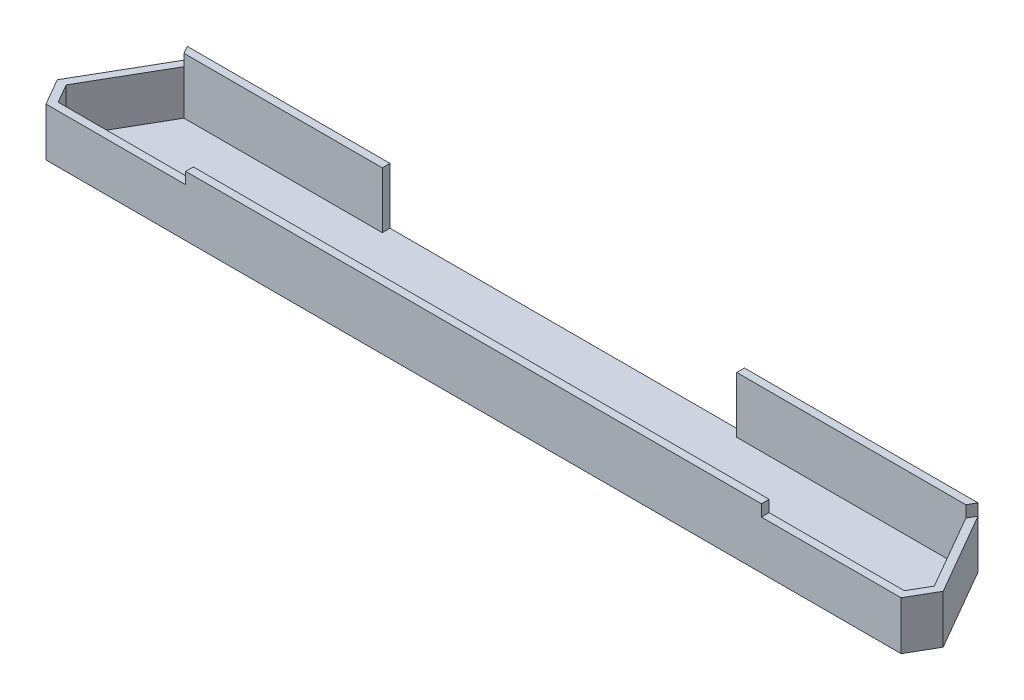
from build123d import *

# Parameters (mm, degrees)
BOSS_EXTRUDE1_DEPTH = 1
BOSS_EXTRUDE2_DEPTH = 12.58
SKETCH1_4_W         = 149.48
SKETCH1_4_H         = 2
BOSS_EXTRUDE3_DEPTH = 15.58
SKETCH1_5_W         = 92.02
SKETCH1_5_H         = 2
BOSS_EXTRUDE4_DEPTH = 1


with BuildPart() as part:
    # Sketch1 → Boss-Extrude1 (new body)
    with BuildSketch(Plane(origin=(0, 0, 0), x_dir=(1, 0, 0), z_dir=(0, 1, 0))):
        Polygon((-50.01, 19.39179677), (-101.494739838, 19.39179677), (-112.690598923, 0), (-109.845299462, -4.92820323), (-74.74, -4.92820323), (74.74, -4.92820323), (109.845299462, -4.92820323), (112.690598923, 0), (101.494739838, 19.39179677), (42.01, 19.39179677), align=None)
    extrude(amount=BOSS_EXTRUDE1_DEPTH)

    # Sketch1<3> → Boss-Extrude2 (add)
    with BuildSketch(Plane(origin=(0, 0, 0), x_dir=(1, 0, 0), z_dir=(0, 1, 0))):
        Polygon((-115, 0), (-111, -6.92820323), (-74.74, -6.92820323), (-74.74, -4.92820323), (-109.845299462, -4.92820323), (-112.690598923, 0), (-101.494739838, 19.39179677), (-102.649440377, 21.39179677), align=None)
        Polygon((115, 0), (111, -6.92820323), (74.74, -6.92820323), (74.74, -4.92820323), (109.845299462, -4.92820323), (112.690598923, 0), (101.494739838, 19.39179677), (102.649440377, 21.39179677), align=None)
    extrude(amount=BOSS_EXTRUDE2_DEPTH)

    # Sketch1<4> → Boss-Extrude3 (add)
    with BuildSketch(Plane(origin=(0, 0, 0), x_dir=(1, 0, 0), z_dir=(0, 1, 0))):
        Polygon((-102.649440377, 21.39179677), (-101.494739838, 19.39179677), (-50.01, 19.39179677), (-50.01, 21.39179677), align=None)
        Polygon((102.649440377, 21.39179677), (101.494739838, 19.39179677), (42.01, 19.39179677), (42.01, 21.39179677), align=None)
        with Locations((0, -5.92820323)):
            Rectangle(SKETCH1_4_W, SKETCH1_4_H)
    extrude(amount=BOSS_EXTRUDE3_DEPTH)

    # Sketch1<5> → Boss-Extrude4 (add)
    with BuildSketch(Plane(origin=(0, 0, 0), x_dir=(1, 0, 0), z_dir=(0, 1, 0))):
        with Locations((-4, 20.39179677)):
            Rectangle(SKETCH1_5_W, SKETCH1_5_H)
    extrude(amount=BOSS_EXTRUDE4_DEPTH)


solid = part.part
